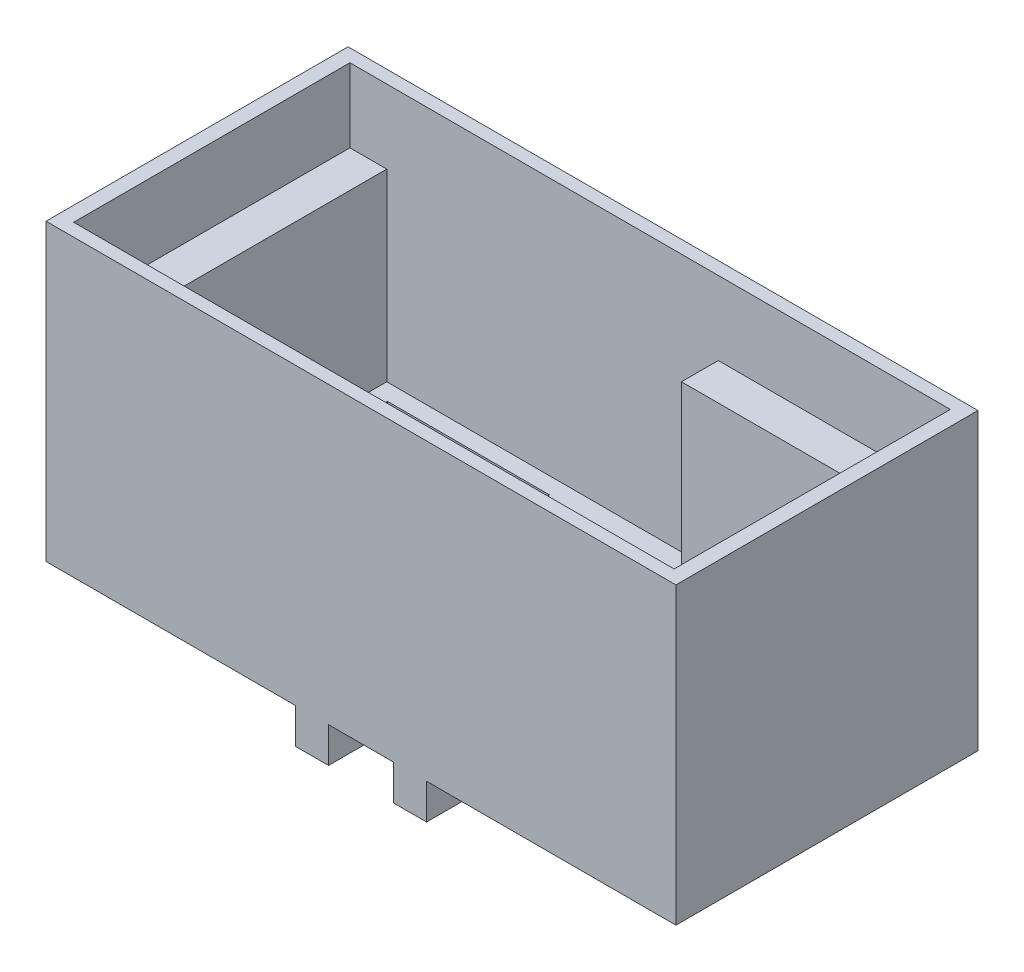
from build123d import *

# Parameters (mm, degrees)
SKETCH1_W           = 85.5
SKETCH1_H           = 41
BOSS_EXTRUDE1_DEPTH = 40
SKETCH2_W           = 4.5
SKETCH2_H           = 41
BOSS_EXTRUDE2_DEPTH = 4.8
SKETCH5_W           = 81.5
SKETCH5_H           = 37.5
CUT_EXTRUDE1_DEPTH  = 10
SKETCH6_W           = 45
SKETCH6_H           = 5
CUT_EXTRUDE2_DEPTH  = 25
SKETCH7_W           = 71.5
SKETCH7_H           = 27.5
CUT_EXTRUDE3_DEPTH  = 25
CUT_EXTRUDE4_REACH  = 60.931
SKETCH10_W          = 22
SKETCH10_H          = 28


with BuildPart() as part:
    # Sketch1 → Boss-Extrude1 (new body)
    with BuildSketch(Plane(origin=(0, 0, 0), x_dir=(1, 0, 0), z_dir=(0, 1, 0))):
        Rectangle(SKETCH1_W, SKETCH1_H)
    extrude(amount=BOSS_EXTRUDE1_DEPTH)

    # Sketch2 → Boss-Extrude2 (add)
    with BuildSketch(Plane.XZ):
        with Locations((-6.65, 0)):
            Rectangle(SKETCH2_W, SKETCH2_H)
        with Locations((6.65, 0)):
            Rectangle(SKETCH2_W, SKETCH2_H)
    extrude(amount=BOSS_EXTRUDE2_DEPTH)

    # Sketch5 → Cut-Extrude1 (cut)
    with BuildSketch(Plane(origin=(0, 40, 0), x_dir=(1, 0, 0), z_dir=(0, 1, 0))):
        Rectangle(SKETCH5_W, SKETCH5_H)
    extrude(amount=-CUT_EXTRUDE1_DEPTH, mode=Mode.SUBTRACT)

    # Sketch6 → Cut-Extrude2 (cut)
    with BuildSketch(Plane(origin=(0, 30, 0), x_dir=(1, 0, 0), z_dir=(0, 1, 0))):
        with Locations((-13.25, 16.25)):
            Rectangle(SKETCH6_W, SKETCH6_H)
        with Locations((13.25, -16.25)):
            Rectangle(SKETCH6_W, SKETCH6_H)
    extrude(amount=-CUT_EXTRUDE2_DEPTH, mode=Mode.SUBTRACT)

    # Sketch7 → Cut-Extrude3 (cut)
    with BuildSketch(Plane(origin=(0, 30, 0), x_dir=(1, 0, 0), z_dir=(0, 1, 0))):
        Rectangle(SKETCH7_W, SKETCH7_H)
    extrude(amount=-CUT_EXTRUDE3_DEPTH, mode=Mode.SUBTRACT)

    # Sketch10 → Cut-Extrude4 (cut, up to next)
    with BuildSketch(Plane(origin=(0, 5, 0), x_dir=(1, 0, 0), z_dir=(0, 1, 0)), mode=Mode.PRIVATE) as cut_extrude4_sk1:
        with Locations((-22.406521178, 2.5)):
            Rectangle(SKETCH10_W, SKETCH10_H)
    cut_extrude4_tool1 = extrude(cut_extrude4_sk1.sketch, amount=-CUT_EXTRUDE4_REACH, mode=Mode.PRIVATE) & part.part
    # Sketch10 → Cut-Extrude4 (cut, up to next)
    with BuildSketch(Plane(origin=(0, 5, 0), x_dir=(1, 0, 0), z_dir=(0, 1, 0)), mode=Mode.PRIVATE) as cut_extrude4_sk2:
        with Locations((22.4125, -2.5)):
            Rectangle(SKETCH10_W, SKETCH10_H)
    cut_extrude4_tool2 = extrude(cut_extrude4_sk2.sketch, amount=-CUT_EXTRUDE4_REACH, mode=Mode.PRIVATE) & part.part
    add(cut_extrude4_tool1.solids().sort_by_distance((-22.406521, 5, -2.5))[0], mode=Mode.SUBTRACT)
    add(cut_extrude4_tool2.solids().sort_by_distance((22.4125, 5, 2.5))[0], mode=Mode.SUBTRACT)


solid = part.part
